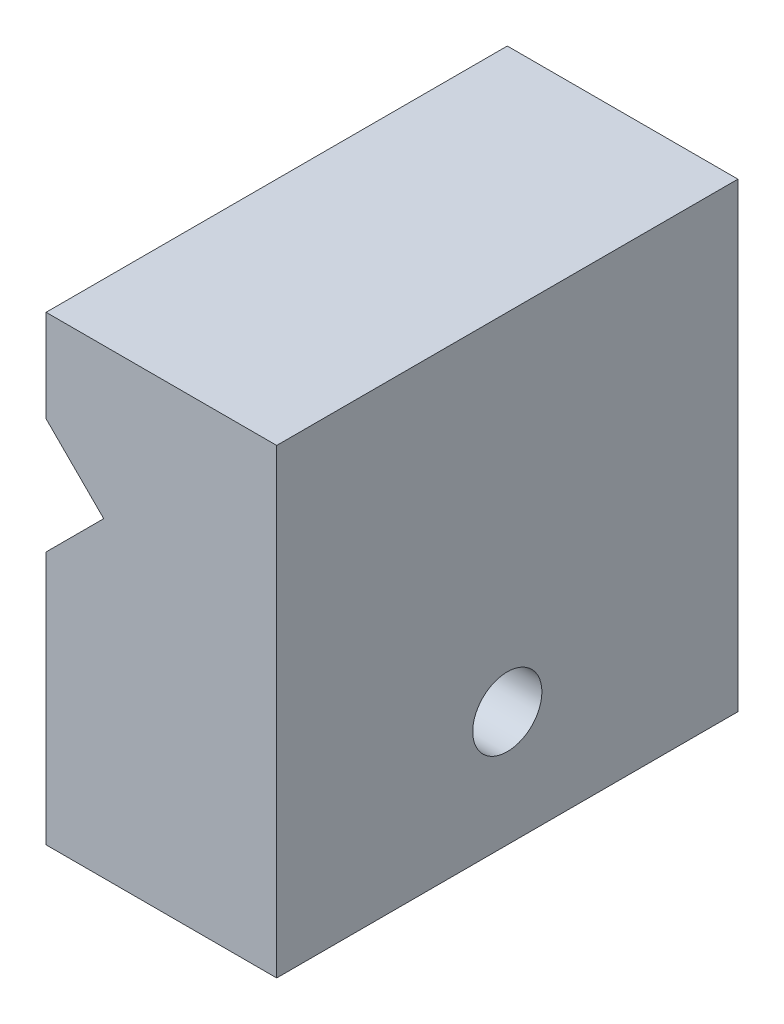
from build123d import *

# Parameters (mm, degrees)
ESQUISSE1_W           = 10
ESQUISSE1_H           = 20
EXTRUSION1_DEPTH      = 20
EXTRUSION2_DEPTH      = 23.912878475
EXTRUSION2_DEPTH_BACK = 23.912878475
ESQUISSE4_R           = 1.5
EXTRUSION3_DEPTH      = 40


with BuildPart() as part:
    # Esquisse1 → Extrusion1 (new body)
    with BuildSketch(Plane.XY):
        Rectangle(ESQUISSE1_W, ESQUISSE1_H)
    extrude(amount=EXTRUSION1_DEPTH)

    # Esquisse3 → Extrusion2 (cut, two sides: drawn at the far end of the back side and taken through both)
    with BuildSketch(Plane.XY.offset(20).offset(-EXTRUSION2_DEPTH_BACK)):
        Polygon((-38.75439594, 39.75439594), (-5, 6), (-2.5, 3.5), (-5, 1), (-38.75439594, -32.75439594), (-134.226244997, -32.75439594), (-134.226244997, 39.75439594), align=None)
    extrude(amount=EXTRUSION2_DEPTH + EXTRUSION2_DEPTH_BACK, mode=Mode.SUBTRACT)

    # Esquisse4 → Extrusion3 (cut)
    with BuildSketch(Plane(origin=(5, 0, 0), x_dir=(0, 0, -1), z_dir=(1, 0, 0))):
        with Locations((-10, -5)):
            Circle(ESQUISSE4_R)
    extrude(amount=-EXTRUSION3_DEPTH, mode=Mode.SUBTRACT)


solid = part.part
